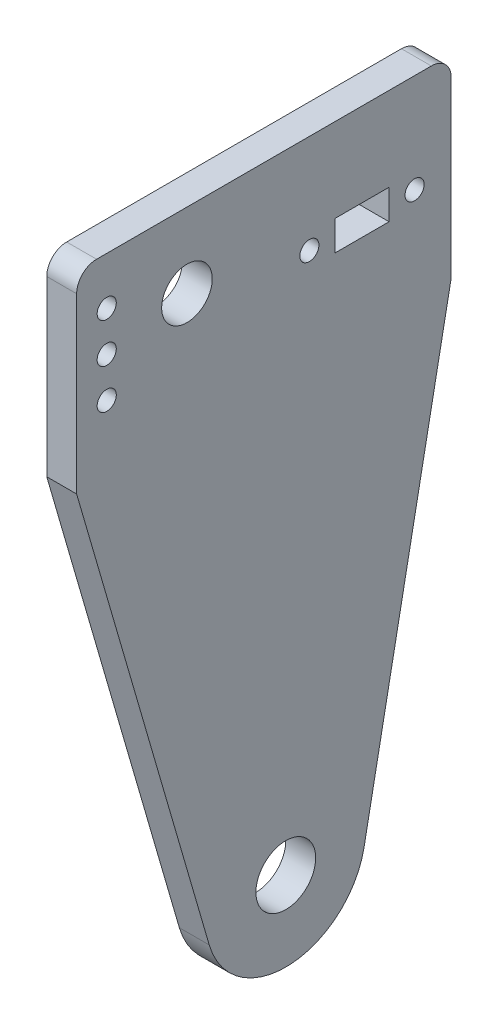
from build123d import *

# Parameters (mm, degrees)
SKETCH1_R           = 4.7625
SKETCH1_R_2         = 4.03225
SKETCH1_R_3         = 1.524
SKETCH1_W           = 8.636
SKETCH1_H           = 4.7625
BOSS_EXTRUDE1_DEPTH = 4.7625


with BuildPart() as part:
    # Sketch1 → Boss-Extrude1 (new body)
    with BuildSketch(Plane(origin=(0, 0, 0), x_dir=(0, 0, -1), z_dir=(1, 0, 0))):
        with BuildLine():
            Line((42.1132, 8.7376), (42.1132, -18.894289209))
            Line((42.1132, -18.894289209), (28.215665755, -90.567816907))
            ThreePointArc((28.215665755, -90.567816907), (16.325222884, -100.837177304), (3.551201687, -91.690222777))
            Line((3.551201687, -91.690222777), (-17.5768, -18.894289209))
            Line((-17.5768, -18.894289209), (-17.5768, 8.7376))
            ThreePointArc((-17.5768, 8.7376), (-16.64686403, 10.98266403), (-14.4018, 11.9126))
            Line((-14.4018, 11.9126), (38.9382, 11.9126))
            ThreePointArc((38.9382, 11.9126), (41.18326403, 10.98266403), (42.1132, 8.7376))
        make_face()
        with Locations(Location((15.747881426, -88.15030705, 0), (0, 0, 180))):
            Circle(SKETCH1_R, mode=Mode.SUBTRACT)
        with Locations(Location((0, 0, 0), (0, 0, 180))):
            Circle(SKETCH1_R_2, mode=Mode.SUBTRACT)
        with Locations(Location((-12.78255, 4.3307, 0), (0, 0, 180))):
            Circle(SKETCH1_R_3, mode=Mode.SUBTRACT)
        with Locations(Location((36.2712, -3.8354, 0), (0, 0, 180))):
            Circle(SKETCH1_R_3, mode=Mode.SUBTRACT)
        with Locations(Location((-12.78255, -2.0193, 0), (0, 0, 180))):
            Circle(SKETCH1_R_3, mode=Mode.SUBTRACT)
        with Locations(Location((-12.78255, -8.3693, 0), (0, 0, 180))):
            Circle(SKETCH1_R_3, mode=Mode.SUBTRACT)
        with Locations(Location((19.5072, -3.8354, 0), (0, 0, 180))):
            Circle(SKETCH1_R_3, mode=Mode.SUBTRACT)
        with Locations((27.8892, -3.8354)):
            Rectangle(SKETCH1_W, SKETCH1_H, mode=Mode.SUBTRACT)
    extrude(amount=BOSS_EXTRUDE1_DEPTH)


solid = part.part
